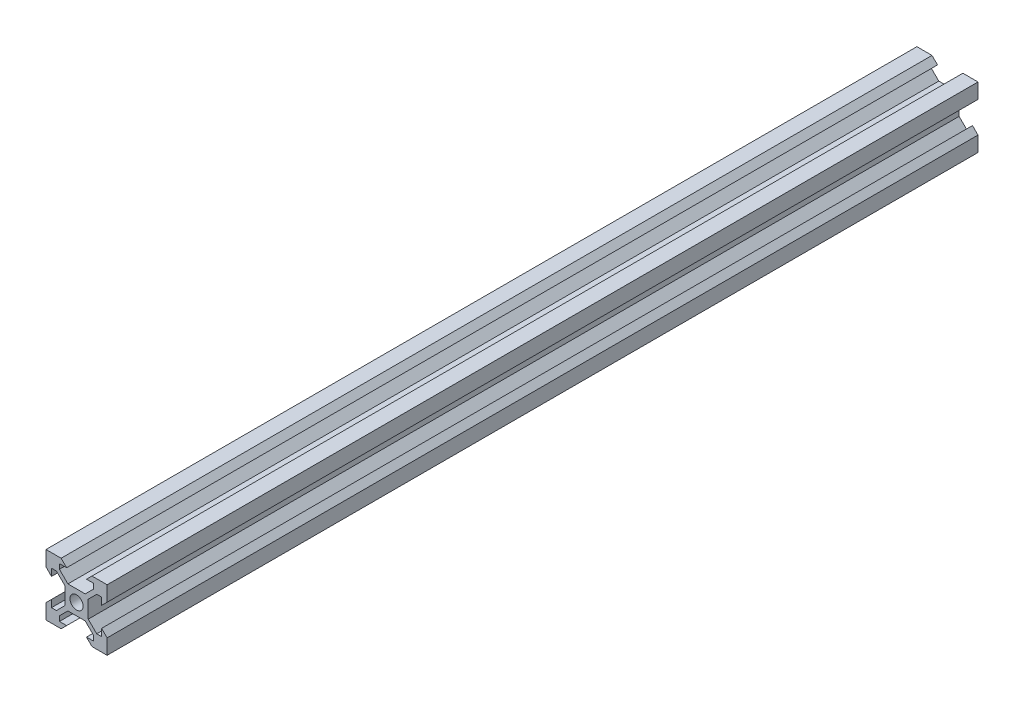
from build123d import *

# Parameters (mm, degrees)
CROQUIS1_R      = 2.15
BOSCHBASE_DEPTH = 285


with BuildPart() as part:
    # Croquis1 → BoschBase (new body)
    with BuildSketch(Plane.XY):
        Polygon((4.4, 0), (0, 0), (0, -0.56736664), (0, -4.4), (0, -4.95), (1.8, -6.75), (1.8, -4.4), (3.410050506, -4.4), (6.175, -7.164949494), (6.175, -12.835050506), (3.410050506, -15.6), (1.8, -15.6), (1.8, -13.25), (0, -15.05), (0, -15.6), (0, -20), (4.4, -20), (4.95, -20), (6.75, -18.2), (4.4, -18.2), (4.4, -16.589949494), (7.164949494, -13.825), (12.835050506, -13.825), (15.6, -16.589949494), (15.6, -18.2), (13.25, -18.2), (15.05, -20), (15.6, -20), (18.2, -20), (20, -20), (20, -15.6), (20, -15.05), (18.2, -13.25), (18.2, -15.6), (16.589949494, -15.6), (13.825, -12.835050506), (13.825, -7.164949494), (16.589949494, -4.4), (18.2, -4.4), (18.2, -6.75), (20, -4.95), (20, -4.4), (20, 0), (15.6, 0), (15.05, 0), (13.25, -1.8), (15.6, -1.8), (15.6, -3.410050506), (12.835050506, -6.175), (7.164949494, -6.175), (4.4, -3.410050506), (4.4, -1.8), (6.75, -1.8), (4.95, 0), align=None)
        with Locations((10, -10)):
            Circle(CROQUIS1_R, mode=Mode.SUBTRACT)
    extrude(amount=BOSCHBASE_DEPTH)


solid = part.part
